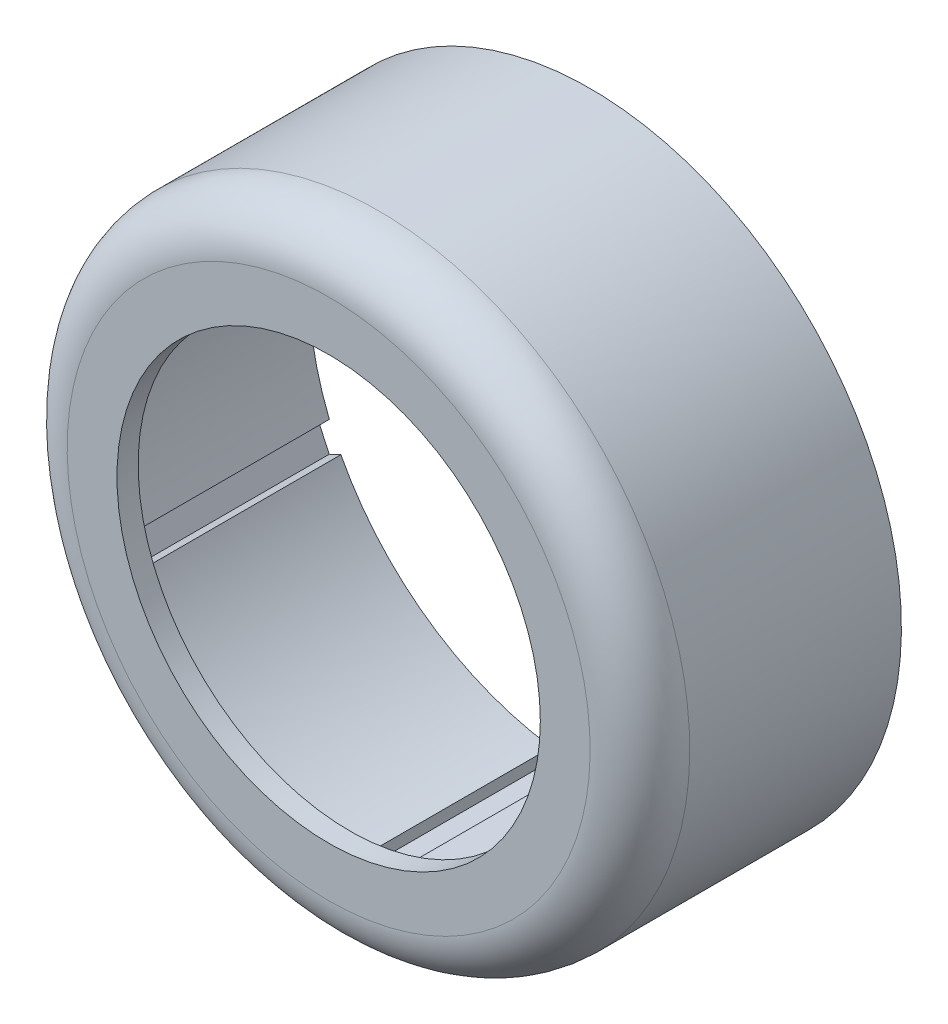
from build123d import *

# Parameters (mm, degrees)
BOSS_EXTRUDE1_START = -242.545742
SKETCH1_R           = 25
BOSS_EXTRUDE1_DEPTH = 21.000001
BOSS_EXTRUDE2_START = -1.7
SKETCH4_R           = 25
SKETCH4_R_2         = 17
BOSS_EXTRUDE2_DEPTH = 1.7
FILLET1_R           = 4


with BuildPart() as part:
    # Sketch1 → Boss-Extrude1 (new body)
    with BuildSketch(Plane.XY.offset(BOSS_EXTRUDE1_START)):
        with Locations(Location((0, 0, 0), (0, 0, 270))):
            Circle(SKETCH1_R)
        with BuildLine():
            Line((-21.875959298, -8.922578372), (-20.951151281, -10.918757254))
            Line((-20.951151281, -10.918757254), (-20.019493054, -10.487130107))
            ThreePointArc((-20.019493054, -10.487130107), (-13.008740953, -18.480602231), (-3.118771073, -22.383772403))
            Line((-3.118771073, -22.383772403), (-3.210800112, -23.40642567))
            Line((-3.210800112, -23.40642567), (-1.019654481, -23.603607875))
            Line((-1.019654481, -23.603607875), (-0.927625442, -22.580954609))
            ThreePointArc((-0.927625442, -22.580954609), (9.500300533, -20.506201252), (17.825529997, -13.892821179))
            Line((17.825529997, -13.892821179), (18.665159186, -14.483847298))
            Line((18.665159186, -14.483847298), (19.931496801, -12.684850621))
            Line((19.931496801, -12.684850621), (19.091867612, -12.093824502))
            ThreePointArc((19.091867612, -12.093824502), (22.509041486, -2.025599021), (20.94430107, 8.490951224))
            Line((20.94430107, 8.490951224), (21.875959298, 8.922578372))
            Line((21.875959298, 8.922578372), (20.951151281, 10.918757254))
            Line((20.951151281, 10.918757254), (20.019493054, 10.487130107))
            ThreePointArc((20.019493054, 10.487130107), (13.008740953, 18.480602231), (3.118771073, 22.383772403))
            Line((3.118771073, 22.383772403), (3.210800112, 23.40642567))
            Line((3.210800112, 23.40642567), (1.019654481, 23.603607875))
            Line((1.019654481, 23.603607875), (0.927625442, 22.580954609))
            ThreePointArc((0.927625442, 22.580954609), (-9.500300533, 20.506201252), (-17.825529997, 13.892821179))
            Line((-17.825529997, 13.892821179), (-18.665159186, 14.483847298))
            Line((-18.665159186, 14.483847298), (-19.931496801, 12.684850621))
            Line((-19.931496801, 12.684850621), (-19.091867612, 12.093824502))
            ThreePointArc((-19.091867612, 12.093824502), (-22.509041486, 2.025599021), (-20.94430107, -8.490951224))
            Line((-20.94430107, -8.490951224), (-21.875959298, -8.922578372))
        make_face(mode=Mode.SUBTRACT)
    extrude(amount=BOSS_EXTRUDE1_DEPTH)

    # Sketch4 → Boss-Extrude2 (add)
    with BuildSketch(Plane.XY.offset(-221.545741472).offset(BOSS_EXTRUDE2_START)):
        with Locations(Location((0, 0, 0), (0, 0, 270))):
            Circle(SKETCH4_R)
        Circle(SKETCH4_R_2, mode=Mode.SUBTRACT)
    extrude(amount=BOSS_EXTRUDE2_DEPTH)

    # Fillet1
    fillet1_edges = [part.edges().sort_by_distance(p)[0] for p in [
        (0, 25, -221.545741),
    ]]
    fillet(fillet1_edges, radius=FILLET1_R)


solid = part.part
